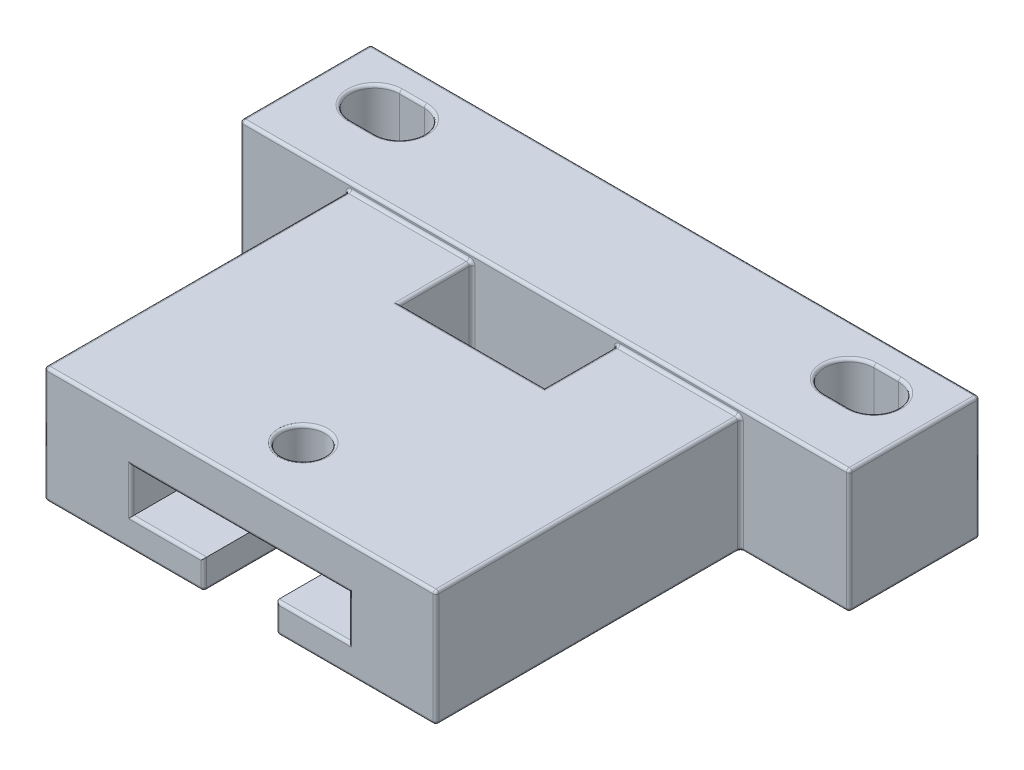
from build123d import *

# Parameters (mm, degrees)
SKETCH2_W           = 42
SKETCH2_H           = 9
BOSS_EXTRUDE1_DEPTH = 8.5
SKETCH3_W           = 27
SKETCH3_H           = 8
BOSS_EXTRUDE2_DEPTH = 21
SKETCH4_W           = 10
SKETCH4_H           = 5
CUT_EXTRUDE1_DEPTH  = 21
CUT_EXTRUDE3_DEPTH  = 10
SKETCH9_R           = 1.5
CUT_EXTRUDE4_DEPTH  = 10
FILLET1_R           = 0.2


with BuildPart() as part:
    # Sketch2 → Boss-Extrude1 (new body)
    with BuildSketch(Plane(origin=(0, 0, 0), x_dir=(1, 0, 0), z_dir=(0, 1, 0))):
        Rectangle(SKETCH2_W, SKETCH2_H)
        with BuildLine():
            Line((-17.2, 2.7), (-15.5, 2.7))
            ThreePointArc((-15.5, 2.7), (-13.8, 1), (-15.5, -0.7))
            Line((-15.5, -0.7), (-17.2, -0.7))
            ThreePointArc((-17.2, -0.7), (-18.9, 1), (-17.2, 2.7))
        make_face(mode=Mode.SUBTRACT)
        with BuildLine():
            Line((17.2, 2.7), (15.5, 2.7))
            ThreePointArc((15.5, 2.7), (13.8, 1), (15.5, -0.7))
            Line((15.5, -0.7), (17.2, -0.7))
            ThreePointArc((17.2, -0.7), (18.9, 1), (17.2, 2.7))
        make_face(mode=Mode.SUBTRACT)
    extrude(amount=BOSS_EXTRUDE1_DEPTH)

    # Sketch3 → Boss-Extrude2 (add)
    with BuildSketch(Plane.XY.offset(4.5)):
        with Locations((0, 4)):
            Rectangle(SKETCH3_W, SKETCH3_H)
    extrude(amount=BOSS_EXTRUDE2_DEPTH)

    # Sketch4 → Cut-Extrude1 (cut)
    with BuildSketch(Plane(origin=(0, 8, 0), x_dir=(1, 0, 0), z_dir=(0, 1, 0))):
        with Locations((0, -7)):
            Rectangle(SKETCH4_W, SKETCH4_H)
    extrude(amount=-CUT_EXTRUDE1_DEPTH, mode=Mode.SUBTRACT)

    # Sketch8 → Cut-Extrude3 (cut)
    with BuildSketch(Plane.XY.offset(25.5)):
        Polygon((2.5, 0), (-2.5, 0), (-2.5, 2), (-7.5, 2), (-7.5, 5.012110836), (7.5, 5.012110836), (7.5, 2), (2.5, 2), align=None)
    extrude(amount=-CUT_EXTRUDE3_DEPTH, mode=Mode.SUBTRACT)

    # Sketch9 → Cut-Extrude4 (cut)
    with BuildSketch(Plane(origin=(0, 8, 0), x_dir=(1, 0, 0), z_dir=(0, 1, 0))):
        with Locations(Location((0, -21.147777112, 0), (0, 0, 180))):
            Circle(SKETCH9_R)
    extrude(amount=-CUT_EXTRUDE4_DEPTH, mode=Mode.SUBTRACT)

    # Fillet1
    fillet1_edges = [part.edges().sort_by_distance(p)[0] for p in [
        (-16.35, 8.5, 0.7),
        (18.9, 0, -1),
        (16.35, 0, -2.7),
        (13.8, 0, -1),
        (16.35, 0, 0.7),
        (-18.9, 8.5, -1),
        (0, 0, -4.5),
        (21, 0, 0),
        (17.25, 0, 4.5),
        (-21, 0, 0),
        (-16.35, 0, -2.7),
        (-18.9, 0, -1),
        (-16.35, 0, 0.7),
        (-13.8, 0, -1),
        (-16.35, 8.5, -2.7),
        (-21, 8.5, 0),
        (-21, 4.25, -4.5),
        (21, 4.25, -4.5),
        (21, 4.25, 4.5),
        (-21, 4.25, 4.5),
        (0, 8.5, 4.5),
        (21, 8.5, 0),
        (0, 8.5, -4.5),
        (-17.25, 0, 4.5),
        (16.35, 8.5, 0.7),
        (13.5, 4, 4.5),
        (13.5, 0, 15),
        (9.25, 8, 4.5),
        (13.5, 8, 15),
        (-13.5, 4, 4.5),
        (-13.5, 8, 15),
        (-13.5, 0, 15),
        (13.5, 4, 25.5),
        (0, 8, 25.5),
        (-13.5, 4, 25.5),
        (-8, 0, 25.5),
        (13.8, 8.5, -1),
        (16.35, 8.5, -2.7),
        (-9.25, 8, 4.5),
        (18.9, 8.5, -1),
        (-5, 0, 7),
        (0, 0, 4.5),
        (-5, 4, 4.5),
        (5, 0, 7),
        (5, 4, 4.5),
        (0, 0, 9.5),
        (-5, 8, 7),
        (0, 8, 9.5),
        (5, 8, 7),
        (8, 0, 25.5),
        (-13.8, 8.5, -1),
        (-5, 2, 15.5),
        (-7.5, 3.506055418, 15.5),
        (0, 5.012110836, 15.5),
        (7.5, 3.506055418, 15.5),
        (5, 2, 15.5),
        (2.5, 1, 15.5),
        (0, 0, 15.5),
        (2.5, 0, 20.5),
        (-2.5, 1, 15.5),
        (-2.5, 0, 20.5),
        (-5, 2, 25.5),
        (-2.5, 1, 25.5),
        (2.5, 1, 25.5),
        (5, 2, 25.5),
        (7.5, 3.506055418, 25.5),
        (0, 5.012110836, 25.5),
        (-7.5, 3.506055418, 25.5),
        (1.5, 8, 21.147777112),
    ]]
    fillet(fillet1_edges, radius=FILLET1_R)


solid = part.part
